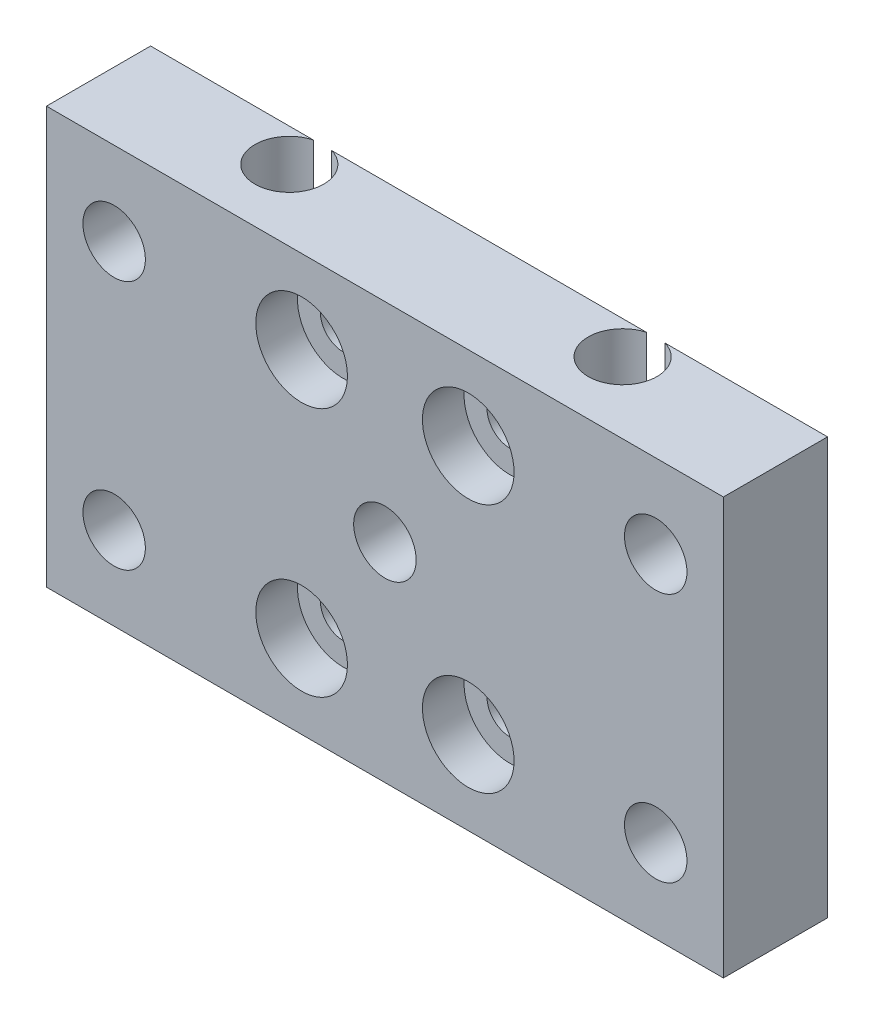
from build123d import *

# Parameters (mm, degrees)
SKETCH1_W                       = 22.5
SKETCH1_H                       = 20
BOSS_EXTRUDE1_DEPTH             = 5
CBORE_FOR_M2_SHCS1_D            = 2.2
CBORE_FOR_M2_SHCS1_CBORE_D      = 4.4
CBORE_FOR_M2_SHCS1_CBORE_DEPTH  = 2
TAP_DRILL_FOR_M2X0_4_TAP1_D     = 3.3
TAP_DRILL_FOR_M2X0_4_TAP1_DEPTH = 6.008579979
TAP_DRILL_FOR_M2X0_4_TAP1_TIP   = 0.991420021
SKETCH9_W                       = 5
SKETCH9_H                       = 20
BOSS_EXTRUDE2_DEPTH             = 5
F_3_0MM_DOWEL_HOLE1_D           = 3
CUT_EXTRUDE1_DEPTH              = 2.4


with BuildPart() as part:
    # Sketch1 → Boss-Extrude1 (new body)
    with BuildSketch(Plane.XY):
        Rectangle(SKETCH1_W, SKETCH1_H)
    extrude(amount=BOSS_EXTRUDE1_DEPTH)

    # CBORE for M2 SHCS1 (through all)
    with Locations(Plane.XY.offset(5)):
        with Locations((4, 6), (-4, -6), (-4, 6), (4, -6)):
            CounterBoreHole(CBORE_FOR_M2_SHCS1_D / 2, CBORE_FOR_M2_SHCS1_CBORE_D / 2, CBORE_FOR_M2_SHCS1_CBORE_DEPTH)

    # Tap Drill for M2x0.4 Tap1
    with Locations(Plane(origin=(0, 10, 0), x_dir=(1, 0, 0), z_dir=(0, 1, 0))):
        with Locations((8, -1.59), (-8, -1.59)):
            Hole(TAP_DRILL_FOR_M2X0_4_TAP1_D / 2, depth=TAP_DRILL_FOR_M2X0_4_TAP1_DEPTH)
            with Locations((0, 0, -(TAP_DRILL_FOR_M2X0_4_TAP1_DEPTH + TAP_DRILL_FOR_M2X0_4_TAP1_TIP / 2))):  # 118° drill point
                Cone(0, TAP_DRILL_FOR_M2X0_4_TAP1_D / 2, TAP_DRILL_FOR_M2X0_4_TAP1_TIP, mode=Mode.SUBTRACT)

    # Sketch9 → Boss-Extrude2 (add)
    with BuildSketch(Plane.XY.offset(5)):
        with Locations((-13.75, 0)):
            Rectangle(SKETCH9_W, SKETCH9_H)
        with Locations((13.75, 0)):
            Rectangle(SKETCH9_W, SKETCH9_H)
    extrude(amount=-BOSS_EXTRUDE2_DEPTH)

    # Ø3.0mm Dowel Hole1 (through all)
    with Locations(Plane.XY.offset(5)):
        with Locations((0, 0), (-13, 6), (-13, -6), (13, -6), (13, 6)):
            Hole(F_3_0MM_DOWEL_HOLE1_D / 2)

    # Sketch12 → Cut-Extrude1 (cut)
    with BuildSketch(Plane(origin=(0, 0, 0), x_dir=(-1, 0, 0), z_dir=(0, 0, -1))):
        Polygon((-13, 2.824573519), (-10.25, 4.41228676), (-10.25, 7.58771324), (-13, 9.175426481), (-15.75, 7.58771324), (-15.75, 4.41228676), align=None)
        Polygon((0, -3.175426481), (2.75, -1.58771324), (2.75, 1.58771324), (0, 3.175426481), (-2.75, 1.58771324), (-2.75, -1.58771324), align=None)
        Polygon((13, 2.824573519), (15.75, 4.41228676), (15.75, 7.58771324), (13, 9.175426481), (10.25, 7.58771324), (10.25, 4.41228676), align=None)
        Polygon((13, -2.824573519), (10.25, -4.41228676), (10.25, -7.58771324), (13, -9.175426481), (15.75, -7.58771324), (15.75, -4.41228676), align=None)
        Polygon((-13, -2.824573519), (-15.75, -4.41228676), (-15.75, -7.58771324), (-13, -9.175426481), (-10.25, -7.58771324), (-10.25, -4.41228676), align=None)
    extrude(amount=-CUT_EXTRUDE1_DEPTH, mode=Mode.SUBTRACT)


solid = part.part
